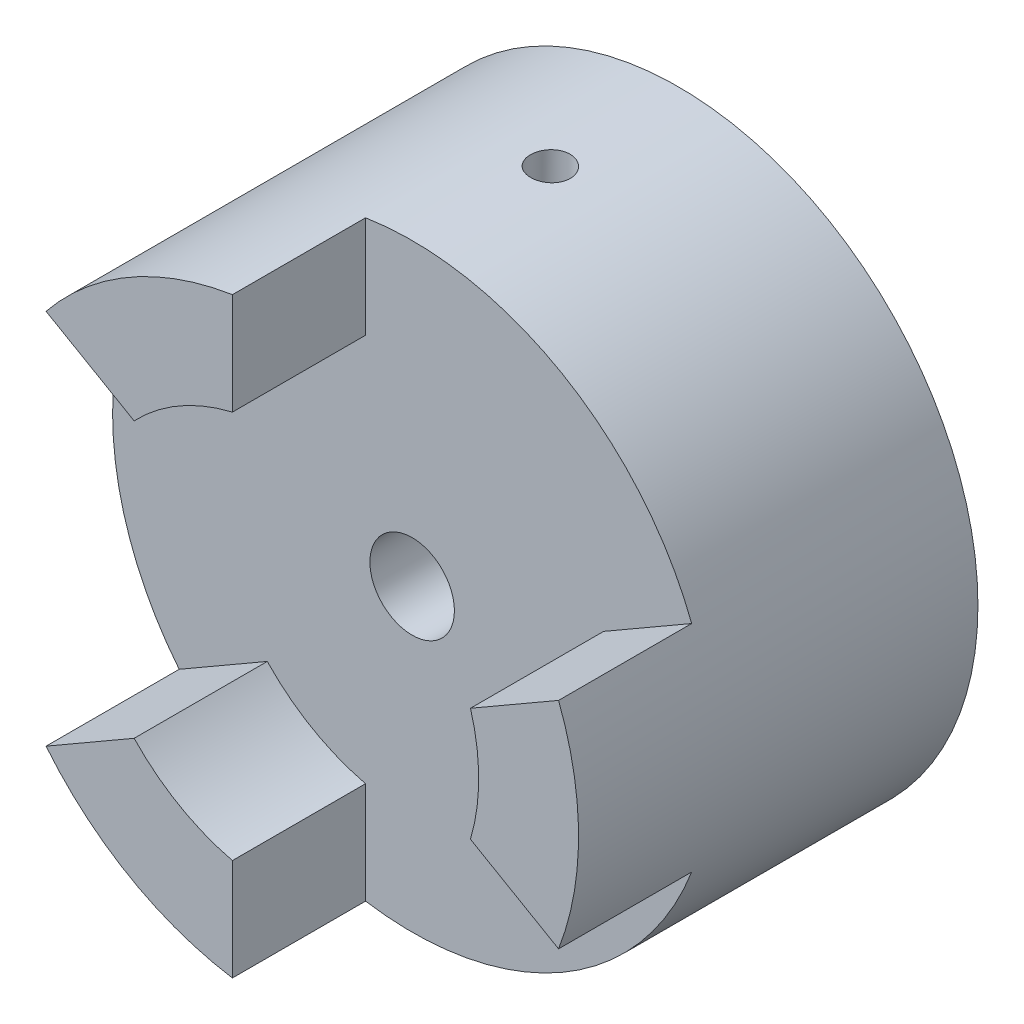
from build123d import *
from build123d.topology import SkipClean

# Parameters (mm, degrees)
SKETCH1_R                 = 22.5
BOSS_EXTRUDE1_DEPTH       = 20
CUT_EXTRUDE1_REACH        = 39.583
SKETCH3_R                 = 3.175
F_3_0MM_DOWEL_HOLE1_D     = 3
F_3_0MM_DOWEL_HOLE1_DEPTH = 22
F_3_0MM_DOWEL_HOLE1_TIP   = 0.901290929
BOSS_EXTRUDE3_DEPTH       = 10


with BuildPart() as part:
    # Sketch1 → Boss-Extrude1 (new body)
    with BuildSketch(Plane.XY):
        Circle(SKETCH1_R)
    extrude(amount=BOSS_EXTRUDE1_DEPTH)

    # Sketch3 → Cut-Extrude1 (cut, up to next)
    with BuildSketch(Plane.XY.offset(20), mode=Mode.PRIVATE) as cut_extrude1_sk1:
        Circle(SKETCH3_R)
    cut_extrude1_tool1 = extrude(cut_extrude1_sk1.sketch, amount=-CUT_EXTRUDE1_REACH, mode=Mode.PRIVATE) & part.part
    add(cut_extrude1_tool1.solids().sort_by_distance((0, 0, 20))[0], mode=Mode.SUBTRACT)

    # Ø3.0mm Dowel Hole1
    with Locations(Plane(origin=(0.332625349, 22.497541207, 9.950983977), x_dir=(0.999890720328, -0.014783348841, 0), z_dir=(0.014783348841, 0.999890720328, 0))):
        with Locations((0, 0)):
            Hole(F_3_0MM_DOWEL_HOLE1_D / 2, depth=F_3_0MM_DOWEL_HOLE1_DEPTH)
            with Locations((0, 0, -(F_3_0MM_DOWEL_HOLE1_DEPTH + F_3_0MM_DOWEL_HOLE1_TIP / 2))):  # 118° drill point
                Cone(0, F_3_0MM_DOWEL_HOLE1_D / 2, F_3_0MM_DOWEL_HOLE1_TIP, mode=Mode.SUBTRACT)

    # Sketch6 → Boss-Extrude3 (add)
    with SkipClean():  # the faces are left unmerged after this step: merging them gives an invalid solid
        with BuildSketch(Plane.XY.offset(20)):
            with BuildLine():
                Line((-17.498376555, 14.144144299), (-10.881805097, 10.324064986))
                ThreePointArc((-10.881805097, 10.324064986), (-7.5, 12.990381057), (-3.5, 14.585952146))
                Line((-3.5, 14.585952146), (-3.5, 22.226110771))
                ThreePointArc((-3.5, 22.226110771), (-11.25, 19.485571585), (-17.498376555, 14.144144299))
            make_face()
            with BuildLine():
                Line((14.381805097, 4.26188716), (20.998376555, 8.081966472))
                ThreePointArc((20.998376555, 8.081966472), (22.5, 0), (20.998376555, -8.081966472))
                Line((20.998376555, -8.081966472), (14.381805097, -4.26188716))
                ThreePointArc((14.381805097, -4.26188716), (15, 0), (14.381805097, 4.26188716))
            make_face()
            with BuildLine():
                Line((-3.5, -14.585952146), (-3.5, -22.226110771))
                ThreePointArc((-3.5, -22.226110771), (-11.25, -19.485571585), (-17.498376555, -14.144144299))
                Line((-17.498376555, -14.144144299), (-10.881805097, -10.324064986))
                ThreePointArc((-10.881805097, -10.324064986), (-7.5, -12.990381057), (-3.5, -14.585952146))
            make_face()
        extrude(amount=BOSS_EXTRUDE3_DEPTH)


solid = part.part
